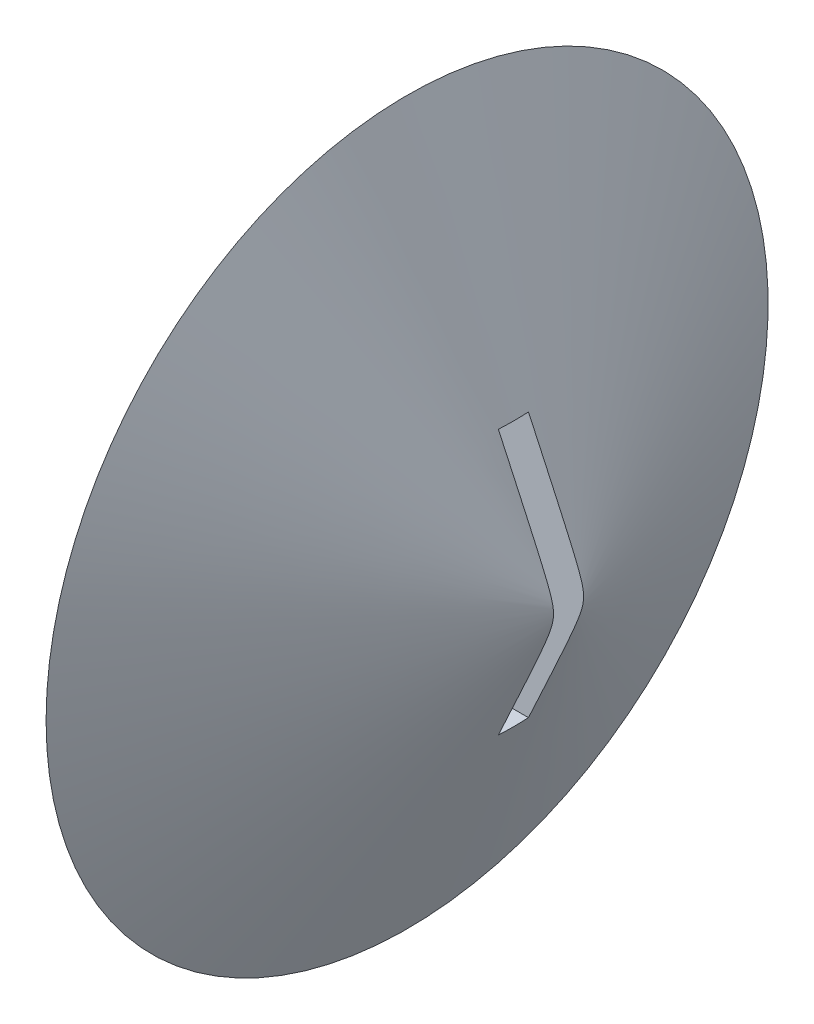
from build123d import *

# Parameters (mm, degrees)
CUT_EXTRUDE_1_DEPTH = 45.676615807


with BuildPart() as part:
    # 草图1 → 旋转1 (revolve)
    with BuildSketch(Plane.XY, mode=Mode.PRIVATE) as revolve_1_sk:
        Polygon((0, 0), (-14, 0), (-14, 30), align=None)
    revolve(revolve_1_sk.sketch.rotate(Axis((-948.087087001, 0, 0), (1, 0, 0)), 90), axis=Axis((-948.087087001, 0, 0), (1, 0, 0)))

    # 草图2 → 切除-拉伸1 (cut, through all)
    with BuildSketch(Plane.ZY.offset(14)):
        Polygon((1.25, 11), (-1.25, 11), (-1.25, 0), (-1.25, -11), (1.25, -11), align=None)
    extrude(amount=-CUT_EXTRUDE_1_DEPTH, mode=Mode.SUBTRACT)


solid = part.part
